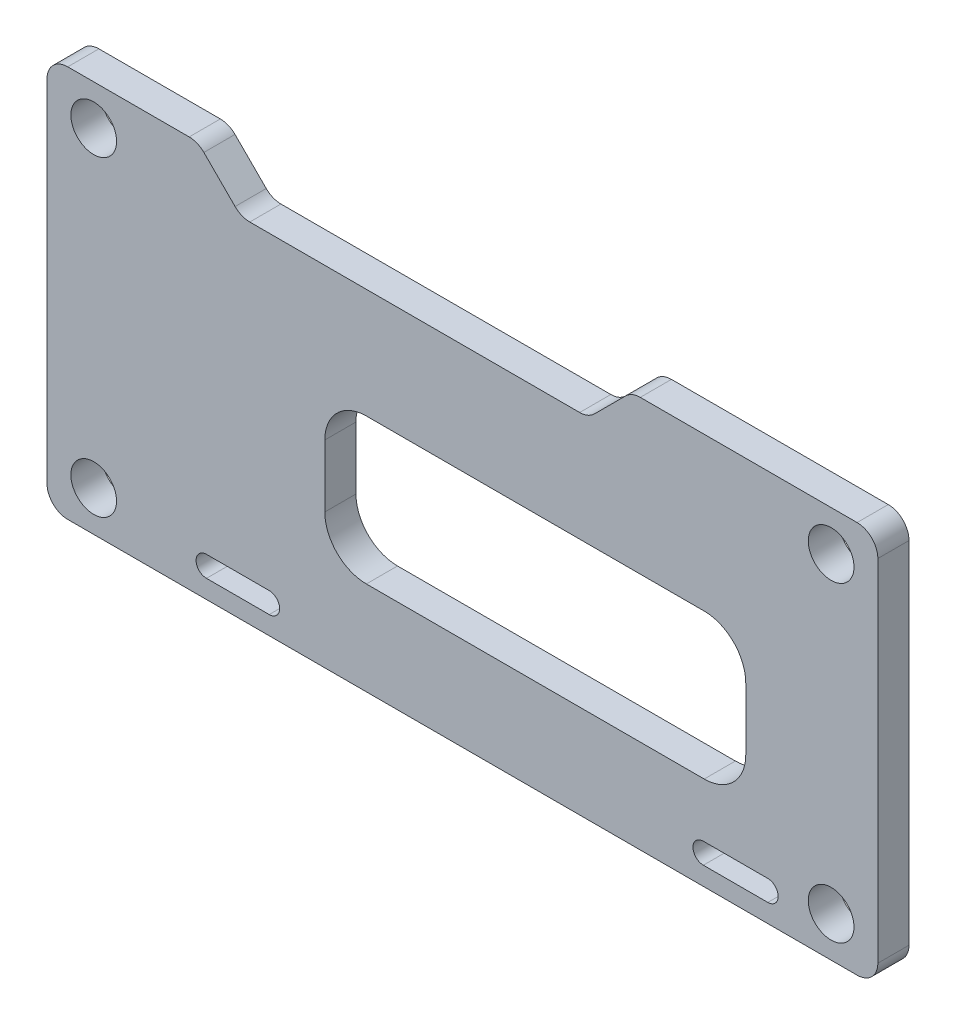
from build123d import *

# Parameters (mm, degrees)
SKETCH_1_W          = 40
SKETCH_1_H          = 18.871619184
SKETCH_1_R          = 1.1
EXTRUDE_1_DEPTH     = 1.5
SKETCH_2_W          = 20.265588098
SKETCH_2_H          = 7.002088202
CUT_EXTRUDE_1_DEPTH = 1.5
FILLET_1_R          = 1
FILLET_2_R          = 1
FILLET_3_R          = 2


with BuildPart() as part:
    # 草图1 → 凸台-拉伸1 (new body)
    with BuildSketch(Plane.XY):
        with Locations((-3.988440653, 2.400990099)):
            Rectangle(SKETCH_1_W, SKETCH_1_H)
        with Locations((-21.738440653, 9.900990099)):
            Circle(SKETCH_1_R, mode=Mode.SUBTRACT)
        with Locations((-21.738440653, -5.099009901)):
            Circle(SKETCH_1_R, mode=Mode.SUBTRACT)
        with Locations((13.761559347, -5.099009901)):
            Circle(SKETCH_1_R, mode=Mode.SUBTRACT)
        with Locations((13.761559347, 9.900990099)):
            Circle(SKETCH_1_R, mode=Mode.SUBTRACT)
    extrude(amount=EXTRUDE_1_DEPTH)

    # 草图2 → 切除-拉伸1 (cut)
    with BuildSketch(Plane.XY.offset(1.5)):
        Polygon((-16.728608447, 11.836799691), (-14.639805099, 9.747996342), (2.071462084, 9.747996342), (5.519738876, 13.196273134), (-14.871851344, 13.196273134), align=None)
        with Locations((-0.480960338, 0.9646533)):
            Rectangle(SKETCH_2_W, SKETCH_2_H)
        with BuildLine():
            Line((-16.310435566, -5.15021554), (-13.288801442, -5.15021554))
            ThreePointArc((-13.288801442, -5.15021554), (-12.788801442, -5.65021554), (-13.288801442, -6.15021554))
            Line((-13.288801442, -6.15021554), (-16.310435566, -6.15021554))
            ThreePointArc((-16.310435566, -6.15021554), (-16.810435566, -5.65021554), (-16.310435566, -5.15021554))
        make_face()
        with BuildLine():
            Line((7.610434302, -5.15021554), (10.713575026, -5.15021554))
            ThreePointArc((10.713575026, -5.15021554), (11.213575026, -5.65021554), (10.713575026, -6.15021554))
            Line((10.713575026, -6.15021554), (7.610434302, -6.15021554))
            ThreePointArc((7.610434302, -6.15021554), (7.110434302, -5.65021554), (7.610434302, -5.15021554))
        make_face()
    extrude(amount=-CUT_EXTRUDE_1_DEPTH, mode=Mode.SUBTRACT)

    # 圆角1
    fillet_1_edges = [part.edges().sort_by_distance(p)[0] for p in [
        (4.160265432, 11.836799691, 0.75),
        (-16.728608447, 11.836799691, 0.75),
        (2.071462084, 9.747996342, 0.75),
        (-14.639805099, 9.747996342, 0.75),
    ]]
    fillet(fillet_1_edges, radius=FILLET_1_R)

    # 圆角2
    fillet_2_edges = [part.edges().sort_by_distance(p)[0] for p in [
        (16.011559347, -7.034819493, 0.75),
        (-23.988440653, -7.034819493, 0.75),
        (-23.988440653, 11.836799691, 0.75),
        (16.011559347, 11.836799691, 0.75),
    ]]
    fillet(fillet_2_edges, radius=FILLET_2_R)

    # 圆角3
    fillet_3_edges = [part.edges().sort_by_distance(p)[0] for p in [
        (9.651833711, 4.465697401, 0.75),
        (9.651833711, -2.536390801, 0.75),
        (-10.613754387, -2.536390801, 0.75),
        (-10.613754387, 4.465697401, 0.75),
    ]]
    fillet(fillet_3_edges, radius=FILLET_3_R)


solid = part.part
